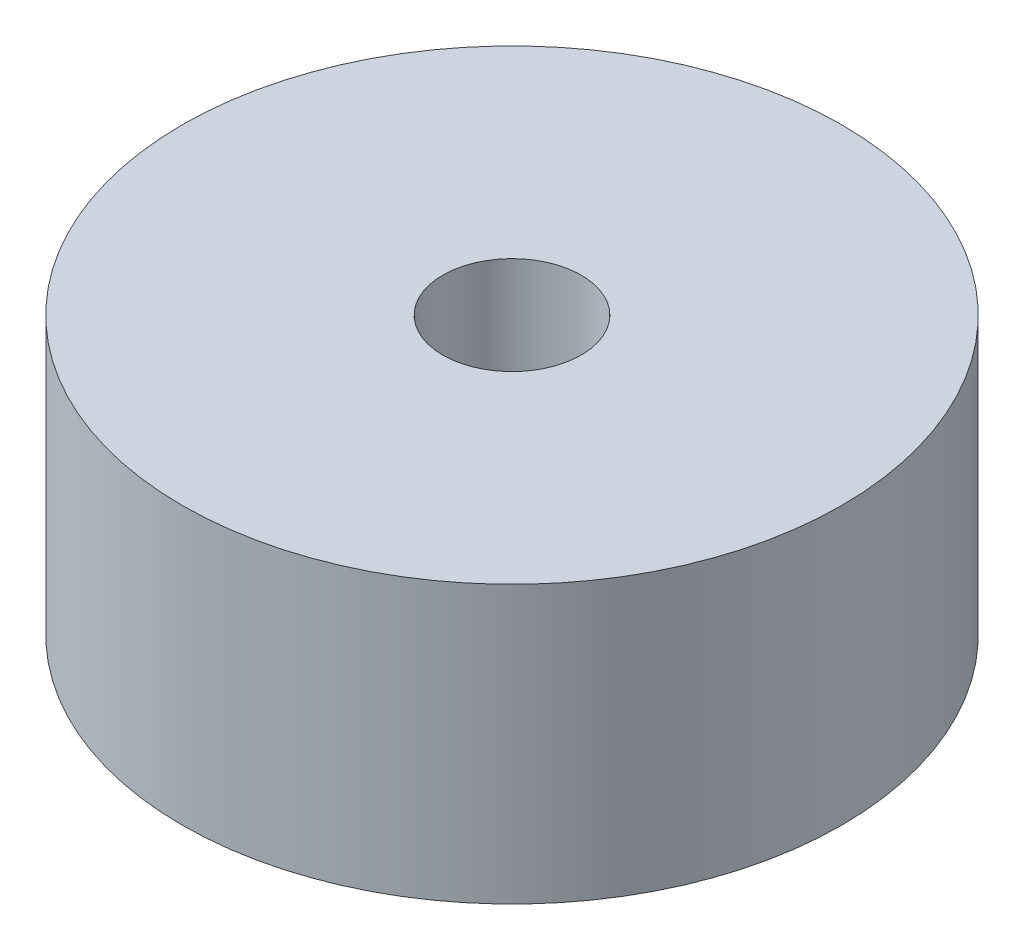
from build123d import *

# Parameters (mm, degrees)
SKETCH1_R           = 9.525
SKETCH1_R_2         = 2
BOSS_EXTRUDE1_DEPTH = 8


with BuildPart() as part:
    # Sketch1 → Boss-Extrude1 (new body)
    with BuildSketch(Plane(origin=(0, 0, 0), x_dir=(1, 0, 0), z_dir=(0, 1, 0))):
        with Locations(Location((0, 0, 0), (0, 0, 270))):
            Circle(SKETCH1_R)
        with Locations(Location((0, 0, 0), (0, 0, 270))):
            Circle(SKETCH1_R_2, mode=Mode.SUBTRACT)
    extrude(amount=BOSS_EXTRUDE1_DEPTH)


solid = part.part
